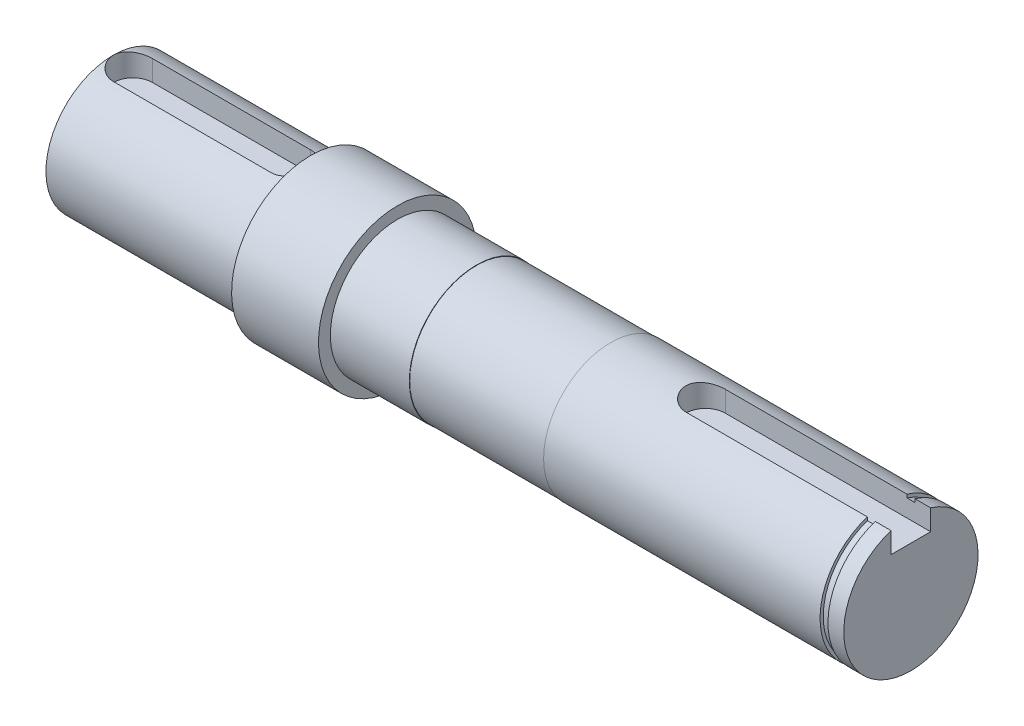
from build123d import *

# Parameters (mm, degrees)
ESBO_O2_W                  = 1
ESBO_O2_H                  = 0.4
CORTE_EXTRUS_O1_DEPTH      = 104.166128162
CORTE_EXTRUS_O1_DEPTH_BACK = 3
CORTE_EXTRUS_O7_DEPTH      = 3
ESBO_O6_W                  = 17
ESBO_O6_H                  = 0.05


with BuildPart() as part:
    # Esboço1 → Revolução1 (revolve)
    with BuildSketch(Plane.XY):
        Polygon((0, 0), (0, 8.5), (25, 8.5), (25, 10), (36, 10), (36, 8.5), (101, 8.5), (101, 0), align=None)
    revolve(axis=Axis((101, 0, 0), (-1, 0, 0)))

    # Esboço2 → Corte-Revolução1 (revolve, cut)
    with BuildSketch(Plane.XY):
        with Locations((98.5, 8.3)):
            Rectangle(ESBO_O2_W, ESBO_O2_H)
    revolve(axis=Axis((0, 0, 0), (1, 0, 0)), mode=Mode.SUBTRACT)

    # Esboço3 → Corte-extrusão1 (cut, two sides: drawn at the far end of the back side and taken through both)
    with BuildSketch(Plane(origin=(0, 8.5, 0), x_dir=(1, 0, 0), z_dir=(0, 1, 0)).offset(-CORTE_EXTRUS_O1_DEPTH_BACK)):
        with BuildLine():
            Line((75, -2.5), (105, -2.5))
            ThreePointArc((105, -2.5), (107.5, 0), (105, 2.5))
            Line((105, 2.5), (75, 2.5))
            ThreePointArc((75, 2.5), (72.5, 0), (75, -2.5))
        make_face()
    extrude(amount=CORTE_EXTRUS_O1_DEPTH + CORTE_EXTRUS_O1_DEPTH_BACK, mode=Mode.SUBTRACT)

    # Esboço5 → Corte-extrusão7 (cut)
    with BuildSketch(Plane(origin=(0, 8.5, 0), x_dir=(-1, 0, 0), z_dir=(0, 1, 0))):
        with BuildLine():
            Line((-2.51, 2.5), (-22.51, 2.5))
            ThreePointArc((-22.51, 2.5), (-25.01, 0), (-22.51, -2.5))
            Line((-22.51, -2.5), (-2.51, -2.5))
            ThreePointArc((-2.51, -2.5), (-0.01, 0), (-2.51, 2.5))
        make_face()
    extrude(amount=-CORTE_EXTRUS_O7_DEPTH, mode=Mode.SUBTRACT)

    # Esboço6 → Corte-Revolução2 (revolve, cut)
    with BuildSketch(Plane(origin=(0, 0, 0), x_dir=(1, 0, 0), z_dir=(0, 1, 0)), mode=Mode.PRIVATE) as corte_revolu_o2_sk:
        with Locations((54.5, 8.475)):
            Rectangle(ESBO_O6_W, ESBO_O6_H)
    revolve(corte_revolu_o2_sk.sketch.rotate(Axis((48.876141687, 0, 0), (1, 0, 0)), 90), axis=Axis((48.876141687, 0, 0), (1, 0, 0)), mode=Mode.SUBTRACT)


solid = part.part
